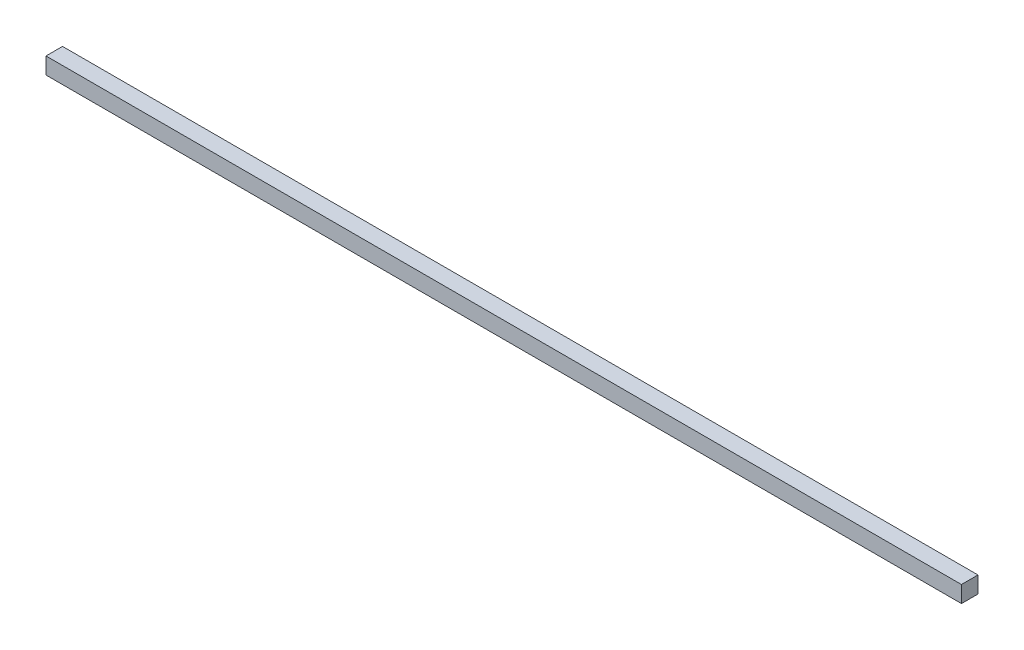
from build123d import *

# Parameters (mm, degrees)
BOSS_EXTRUDE1_START = -654.949492
SKETCH1_W           = 20
SKETCH1_H           = 20
BOSS_EXTRUDE1_DEPTH = 1106.8


with BuildPart() as part:
    # Sketch1 → Boss-Extrude1 (new body)
    with BuildSketch(Plane(origin=(0, 0, 0), x_dir=(0, 0, -1), z_dir=(1, 0, 0)).offset(BOSS_EXTRUDE1_START)):
        with Locations((14.642857143, -30.892857143)):
            Rectangle(SKETCH1_W, SKETCH1_H)
    extrude(amount=BOSS_EXTRUDE1_DEPTH)


solid = part.part
